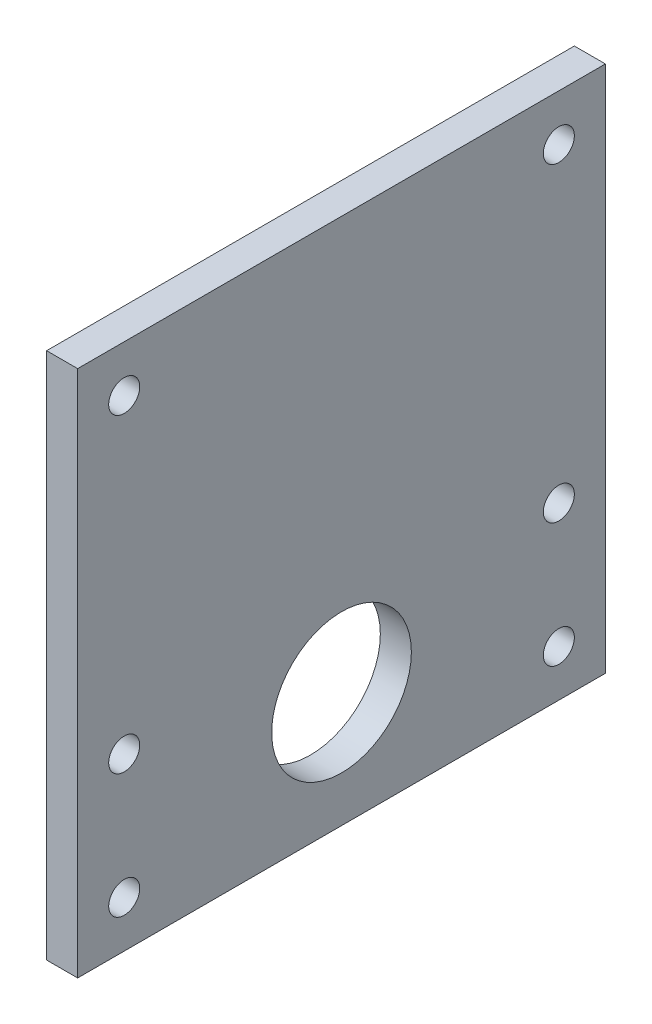
from build123d import *

# Parameters (mm, degrees)
SKETCH1_W           = 107.95
SKETCH1_H           = 107.95
SKETCH1_R           = 3.175
SKETCH1_R_2         = 14.2875
BOSS_EXTRUDE1_DEPTH = 3.175


with BuildPart() as part:
    # Sketch1 → Boss-Extrude1 (new, symmetric)
    with BuildSketch(Plane(origin=(0, 0, 0), x_dir=(0, 0, -1), z_dir=(1, 0, 0))):
        Rectangle(SKETCH1_W, SKETCH1_H)
        with Locations((-44.45, 44.45)):
            Circle(SKETCH1_R, mode=Mode.SUBTRACT)
        with Locations((-44.45, -19.05)):
            Circle(SKETCH1_R, mode=Mode.SUBTRACT)
        with Locations((-44.45, -44.45)):
            Circle(SKETCH1_R, mode=Mode.SUBTRACT)
        with Locations((44.45, -44.45)):
            Circle(SKETCH1_R, mode=Mode.SUBTRACT)
        with Locations((44.45, -19.05)):
            Circle(SKETCH1_R, mode=Mode.SUBTRACT)
        with Locations((44.45, 44.45)):
            Circle(SKETCH1_R, mode=Mode.SUBTRACT)
        with Locations((0, -30.357466082)):
            Circle(SKETCH1_R_2, mode=Mode.SUBTRACT)
    extrude(amount=BOSS_EXTRUDE1_DEPTH, both=True)


solid = part.part
